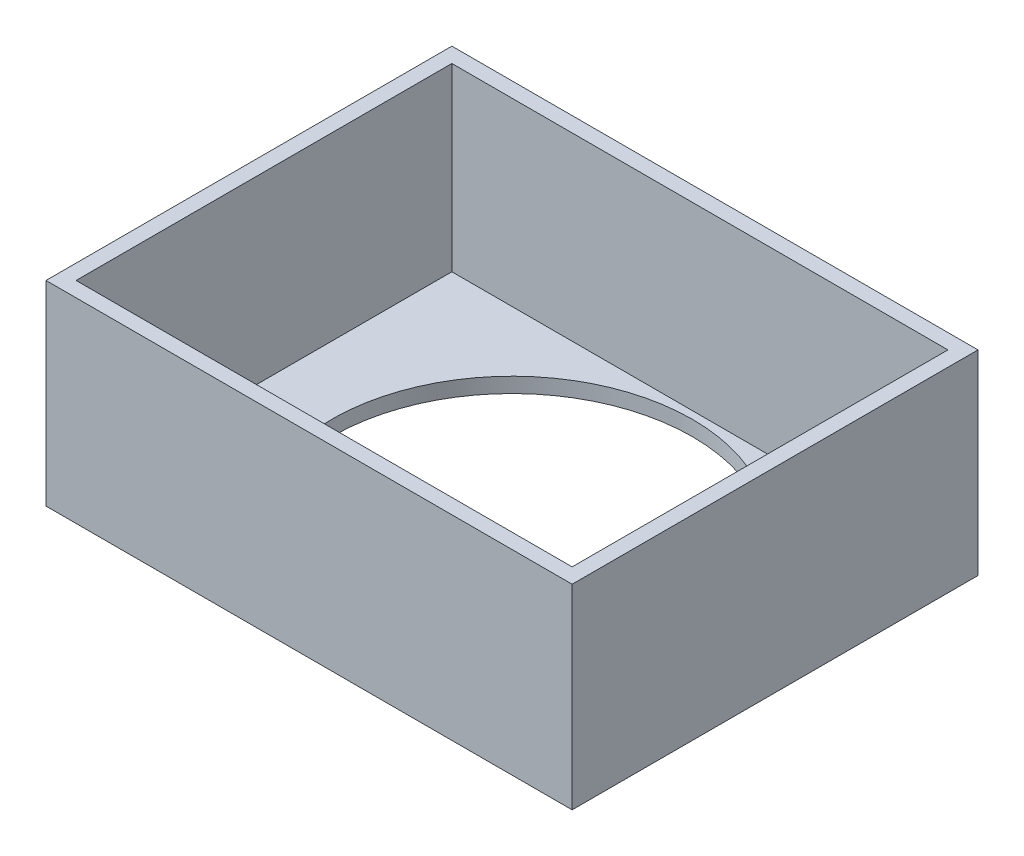
from build123d import *

# Parameters (mm, degrees)
SKETCH_1_W          = 35
SKETCH_1_H          = 27
EXTRUDE_1_DEPTH     = 13
CUT_EXTRUDE_START   = 1
SKETCH_2_W          = 33
SKETCH_2_H          = 25
CUT_EXTRUDE_1_DEPTH = 15
SKETCH_3_R          = 12
CUT_EXTRUDE_2_DEPTH = 26.64176281


with BuildPart() as part:
    # 스케치1 → 보스-돌출1 (new body)
    with BuildSketch(Plane(origin=(0, 0, 0), x_dir=(1, 0, 0), z_dir=(0, 1, 0))):
        Rectangle(SKETCH_1_W, SKETCH_1_H)
    extrude(amount=EXTRUDE_1_DEPTH)

    # 스케치2 → 컷-돌출1 (cut)
    with BuildSketch(Plane(origin=(0, 0, 0), x_dir=(1, 0, 0), z_dir=(0, 1, 0)).offset(CUT_EXTRUDE_START)):
        Rectangle(SKETCH_2_W, SKETCH_2_H)
    extrude(amount=CUT_EXTRUDE_1_DEPTH, mode=Mode.SUBTRACT)

    # 스케치3 → 컷-돌출2 (cut, through all)
    with BuildSketch(Plane(origin=(0, 0, 0), x_dir=(1, 0, 0), z_dir=(0, 1, 0))):
        with Locations(Location((0, 0, 0), (0, 0, 90))):
            Circle(SKETCH_3_R)
    extrude(amount=CUT_EXTRUDE_2_DEPTH, mode=Mode.SUBTRACT)


solid = part.part
